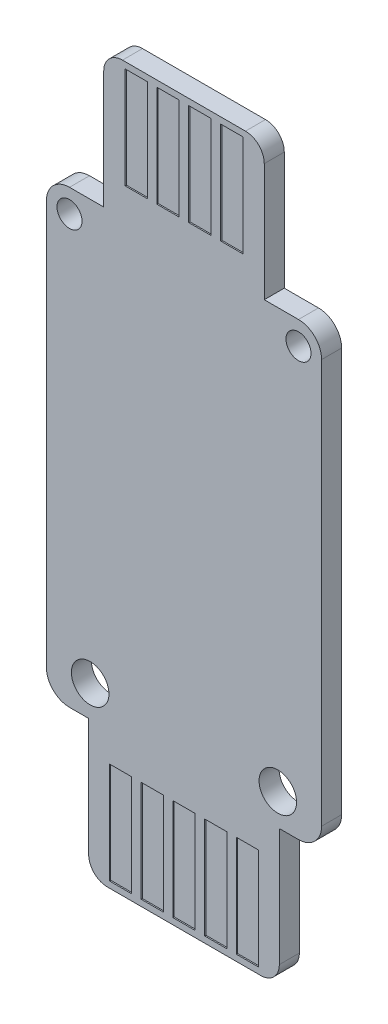
from build123d import *

# Parameters (mm, degrees)
SKETCH_1_R          = 1
EXTRUDE_1_DEPTH     = 1.6
SKETCH_3_R          = 1.5
CUT_EXTRUDE_1_DEPTH = 1.6
CUT_EXTRUDE_2_DEPTH = 1.6
EXTRUDE_2_DEPTH     = 1.6
SKETCH_8_W          = 1.78
SKETCH_8_H          = 8.1
CUT_EXTRUDE_3_DEPTH = 0.1
CUT_EXTRUDE_START   = 1.6
SKETCH_9_W          = 1.78
SKETCH_9_H          = 8.1
CUT_EXTRUDE_4_DEPTH = 0.1
EXTRUDE_3_DEPTH     = 1.6
SKETCH_12_W         = 1.78
SKETCH_12_H         = 8.1
CUT_EXTRUDE_5_DEPTH = 0.1
SKETCH_13_W         = 1.78
SKETCH_13_H         = 8.1
CUT_EXTRUDE_6_DEPTH = 0.1


with BuildPart() as part:
    # 草图1 → 凸台-拉伸1 (new body)
    with BuildSketch(Plane.XY):
        with BuildLine():
            Line((-9.15, 16), (9.15, 16))
            ThreePointArc((9.15, 16), (10.458147545, 15.458147545), (11, 14.15))
            Line((11, 14.15), (11, -20))
            Line((11, -20), (-11, -20))
            Line((-11, -20), (-11, 14.15))
            ThreePointArc((-11, 14.15), (-10.458147545, 15.458147545), (-9.15, 16))
        make_face()
        with Locations((-9.15, 14.15)):
            Circle(SKETCH_1_R, mode=Mode.SUBTRACT)
        with Locations((9.15, 14.15)):
            Circle(SKETCH_1_R, mode=Mode.SUBTRACT)
    extrude(amount=EXTRUDE_1_DEPTH)

    # 草图3 → 切除-拉伸1 (cut)
    with BuildSketch(Plane.XY):
        with Locations((-7.5, -17.5)):
            Circle(SKETCH_3_R)
        with Locations((7.5, -17.5)):
            Circle(SKETCH_3_R)
    extrude(amount=CUT_EXTRUDE_1_DEPTH, mode=Mode.SUBTRACT)

    # 草图5 → 切除-拉伸2 (cut)
    with BuildSketch(Plane.XY):
        with BuildLine():
            Line((11, -20), (11, -18.15))
            ThreePointArc((11, -18.15), (10.458147545, -19.458147545), (9.15, -20))
            Line((9.15, -20), (11, -20))
        make_face()
        with BuildLine():
            Line((-11, -20), (-9.15, -20))
            ThreePointArc((-9.15, -20), (-10.458147545, -19.458147545), (-11, -18.15))
            Line((-11, -18.15), (-11, -20))
        make_face()
    extrude(amount=CUT_EXTRUDE_2_DEPTH, mode=Mode.SUBTRACT)

    # 草图7 → 凸台-拉伸2 (add)
    with BuildSketch(Plane.XY):
        with BuildLine():
            Line((-4.915, 26.92), (4.915, 26.92))
            ThreePointArc((4.915, 26.92), (5.975660172, 26.480660172), (6.415, 25.42))
            Line((6.415, 25.42), (6.415, 16))
            Line((6.415, 16), (-6.415, 16))
            Line((-6.415, 16), (-6.415, 25.42))
            ThreePointArc((-6.415, 25.42), (-5.975660172, 26.480660172), (-4.915, 26.92))
        make_face()
        with BuildLine():
            Line((-6.415, -20), (6.415, -20))
            Line((6.415, -20), (6.415, -29.42))
            ThreePointArc((6.415, -29.42), (5.975660172, -30.480660172), (4.915, -30.92))
            Line((4.915, -30.92), (-4.915, -30.92))
            ThreePointArc((-4.915, -30.92), (-5.975660172, -30.480660172), (-6.415, -29.42))
            Line((-6.415, -29.42), (-6.415, -20))
        make_face()
    extrude(amount=EXTRUDE_2_DEPTH)

    # 草图8 → 切除-拉伸3 (cut)
    with BuildSketch(Plane.XY):
        with Locations((-1.27, 22.37)):
            Rectangle(SKETCH_8_W, SKETCH_8_H)
        with Locations((-3.81, 22.37)):
            Rectangle(SKETCH_8_W, SKETCH_8_H)
        with Locations((3.81, 22.37)):
            Rectangle(SKETCH_8_W, SKETCH_8_H)
        with Locations((1.27, 22.37)):
            Rectangle(SKETCH_8_W, SKETCH_8_H)
        with Locations((1.27, -26.37)):
            Rectangle(SKETCH_8_W, SKETCH_8_H)
        with Locations((3.81, -26.37)):
            Rectangle(SKETCH_8_W, SKETCH_8_H)
        with Locations((-3.81, -26.37)):
            Rectangle(SKETCH_8_W, SKETCH_8_H)
        with Locations((-1.27, -26.37)):
            Rectangle(SKETCH_8_W, SKETCH_8_H)
    extrude(amount=CUT_EXTRUDE_3_DEPTH, mode=Mode.SUBTRACT)

    # 草图9 → 切除-拉伸4 (cut)
    with BuildSketch(Plane.XY.offset(CUT_EXTRUDE_START)):
        with Locations((-1.27, 22.37)):
            Rectangle(SKETCH_9_W, SKETCH_9_H)
        with Locations((1.27, 22.37)):
            Rectangle(SKETCH_9_W, SKETCH_9_H)
        with Locations((3.81, 22.37)):
            Rectangle(SKETCH_9_W, SKETCH_9_H)
        with Locations((-3.81, 22.37)):
            Rectangle(SKETCH_9_W, SKETCH_9_H)
        with Locations((-1.27, -26.37)):
            Rectangle(SKETCH_9_W, SKETCH_9_H)
        with Locations((-3.81, -26.37)):
            Rectangle(SKETCH_9_W, SKETCH_9_H)
        with Locations((3.81, -26.37)):
            Rectangle(SKETCH_9_W, SKETCH_9_H)
        with Locations((1.27, -26.37)):
            Rectangle(SKETCH_9_W, SKETCH_9_H)
    extrude(amount=-CUT_EXTRUDE_4_DEPTH, mode=Mode.SUBTRACT)

    # 草图11 → 凸台-拉伸3 (add)
    with BuildSketch(Plane.XY):
        with BuildLine():
            Line((-7.62, -20), (7.62, -20))
            Line((7.62, -20), (7.62, -29.42))
            ThreePointArc((7.62, -29.42), (7.180660172, -30.480660172), (6.12, -30.92))
            Line((6.12, -30.92), (-6.12, -30.92))
            ThreePointArc((-6.12, -30.92), (-7.180660172, -30.480660172), (-7.62, -29.42))
            Line((-7.62, -29.42), (-7.62, -20))
        make_face()
    extrude(amount=EXTRUDE_3_DEPTH)

    # 草图12 → 切除-拉伸5 (cut)
    with BuildSketch(Plane.XY):
        with Locations((2.54, -26.37)):
            Rectangle(SKETCH_12_W, SKETCH_12_H)
        with Locations((0, -26.37)):
            Rectangle(SKETCH_12_W, SKETCH_12_H)
        with Locations((5.08, -26.37)):
            Rectangle(SKETCH_12_W, SKETCH_12_H)
        with Locations((-2.54, -26.37)):
            Rectangle(SKETCH_12_W, SKETCH_12_H)
        with Locations((-5.08, -26.37)):
            Rectangle(SKETCH_12_W, SKETCH_12_H)
    extrude(amount=CUT_EXTRUDE_5_DEPTH, mode=Mode.SUBTRACT)

    # 草图13 → 切除-拉伸6 (cut)
    with BuildSketch(Plane.XY.offset(CUT_EXTRUDE_START)):
        with Locations((0, -26.37)):
            Rectangle(SKETCH_13_W, SKETCH_13_H)
        with Locations((2.54, -26.37)):
            Rectangle(SKETCH_13_W, SKETCH_13_H)
        with Locations((-5.08, -26.37)):
            Rectangle(SKETCH_13_W, SKETCH_13_H)
        with Locations((-2.54, -26.37)):
            Rectangle(SKETCH_13_W, SKETCH_13_H)
        with Locations((5.08, -26.37)):
            Rectangle(SKETCH_13_W, SKETCH_13_H)
    extrude(amount=-CUT_EXTRUDE_6_DEPTH, mode=Mode.SUBTRACT)


solid = part.part
